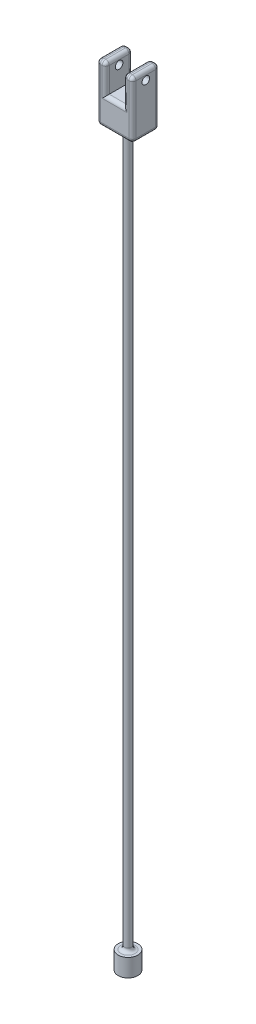
from build123d import *

# Parameters (mm, degrees)
SKETCH1_R                     = 5.525
CORK_STOPPER_VACUMMPUMP_DEPTH = 10
SKETCH3_R                     = 2
LONGTHINSHAFT_DEPTH           = 400
SKETCH4_W                     = 20
SKETCH4_H                     = 15
BOSS_EXTRUDE3_DEPTH           = 32
CUT_EXTRUDE2_REACH            = 444.367
SKETCH5_W                     = 10
SKETCH5_H                     = 16
SKETCH7_R                     = 2.125
CUT_EXTRUDE3_DEPTH            = 20
FILLET1_R                     = 2
FILLET2_R                     = 2
FILLET3_R                     = 2


with BuildPart() as part:
    # Sketch1 → Cork/Stopper/VacummPump (new body)
    with BuildSketch(Plane(origin=(0, 0, 0), x_dir=(1, 0, 0), z_dir=(0, 1, 0))):
        with Locations(Location((0, 0, 0), (0, 0, 270))):
            Circle(SKETCH1_R)
    extrude(amount=CORK_STOPPER_VACUMMPUMP_DEPTH)

    # Sketch3 → LongThinShaft (add)
    with BuildSketch(Plane(origin=(0, 10, 0), x_dir=(1, 0, 0), z_dir=(0, 1, 0))):
        with Locations(Location((0, 0, 0), (0, 0, 270))):
            Circle(SKETCH3_R)
    extrude(amount=LONGTHINSHAFT_DEPTH)

    # Sketch4 → Boss-Extrude3 (add)
    with BuildSketch(Plane(origin=(0, 410, 0), x_dir=(1, 0, 0), z_dir=(0, 1, 0))):
        Rectangle(SKETCH4_W, SKETCH4_H)
    extrude(amount=BOSS_EXTRUDE3_DEPTH)

    # Sketch5 → Cut-Extrude2 (cut, up to next)
    with BuildSketch(Plane.XY.offset(7.5), mode=Mode.PRIVATE) as cut_extrude2_sk1:
        with Locations((0, 434)):
            Rectangle(SKETCH5_W, SKETCH5_H)
    cut_extrude2_tool1 = extrude(cut_extrude2_sk1.sketch, amount=-CUT_EXTRUDE2_REACH, mode=Mode.PRIVATE) & part.part
    add(cut_extrude2_tool1.solids().sort_by_distance((0, 434, 7.5))[0], mode=Mode.SUBTRACT)

    # Sketch7 → Cut-Extrude3 (cut)
    with BuildSketch(Plane.ZY.offset(10)):
        with Locations((0, 437.5)):
            Circle(SKETCH7_R)
    extrude(amount=-CUT_EXTRUDE3_DEPTH, mode=Mode.SUBTRACT)

    # Fillet1
    fillet1_edges = [part.edges().sort_by_distance(p)[0] for p in [
        (0, 410, -2),
    ]]
    fillet(fillet1_edges, radius=FILLET1_R)

    # Fillet2
    fillet2_edges = [part.edges().sort_by_distance(p)[0] for p in [
        (10, 410, 0),
        (10, 426, 7.5),
        (0, 410, -7.5),
        (10, 426, -7.5),
        (-10, 410, 0),
        (-10, 426, -7.5),
        (0, 410, 7.5),
        (-10, 426, 7.5),
        (10, 442, 0),
        (7.5, 442, -7.5),
        (-10, 442, 0),
        (-7.5, 442, 7.5),
        (-7.5, 442, -7.5),
        (7.5, 442, 7.5),
        (-5, 442, 0),
        (5, 434, -7.5),
        (5, 442, 0),
        (5, 434, 7.5),
        (-5, 434, 7.5),
        (0, 426, 7.5),
        (0, 426, -7.5),
        (-5, 434, -7.5),
    ]]
    fillet(fillet2_edges, radius=FILLET2_R)

    # Fillet3
    fillet3_edges = [part.edges().sort_by_distance(p)[0] for p in [
        (0, 10, -2),
    ]]
    fillet(fillet3_edges, radius=FILLET3_R)


solid = part.part
